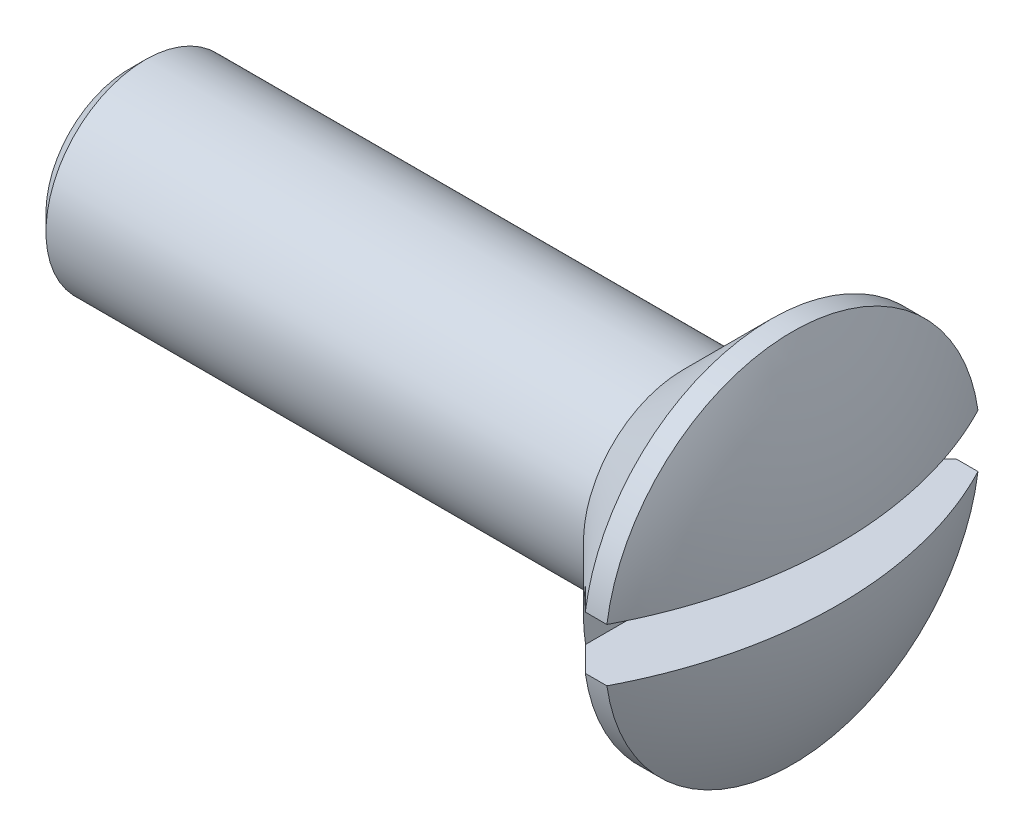
from build123d import *

# Parameters (mm, degrees)
SKETCH2_W          = 11.3
SKETCH2_H          = 1.6
CUT_EXTRUDE1_DEPTH = 2.8
CHAMFER1_SIZE      = 0.5


with BuildPart() as part:
    # Sketch1 → Revolve1 (revolve)
    with BuildSketch(Plane.XY):
        with BuildLine():
            Line((-1.4, 5.65), (-2.05, 5.65))
            Line((-2.05, 5.65), (-4.7, 3))
            Line((-4.7, 3), (-21.4, 3))
            Line((-21.4, 3), (-21.4, 0))
            Line((-21.4, 0), (0, 0))
            ThreePointArc((0, 0), (-0.355213526, 2.910433816), (-1.4, 5.65))
        make_face()
    revolve(axis=Axis((0, 0, 0), (-1, 0, 0)))

    # Sketch2 → Cut-Extrude1 (cut)
    with BuildSketch(Plane(origin=(0, 0, 0), x_dir=(0, 0, -1), z_dir=(1, 0, 0))):
        Rectangle(SKETCH2_W, SKETCH2_H)
    extrude(amount=-CUT_EXTRUDE1_DEPTH, mode=Mode.SUBTRACT)

    # Chamfer1
    chamfer1_edges = [part.edges().sort_by_distance(p)[0] for p in [
        (-21.4, -3, 0),
    ]]
    chamfer(chamfer1_edges, length=CHAMFER1_SIZE)


solid = part.part
